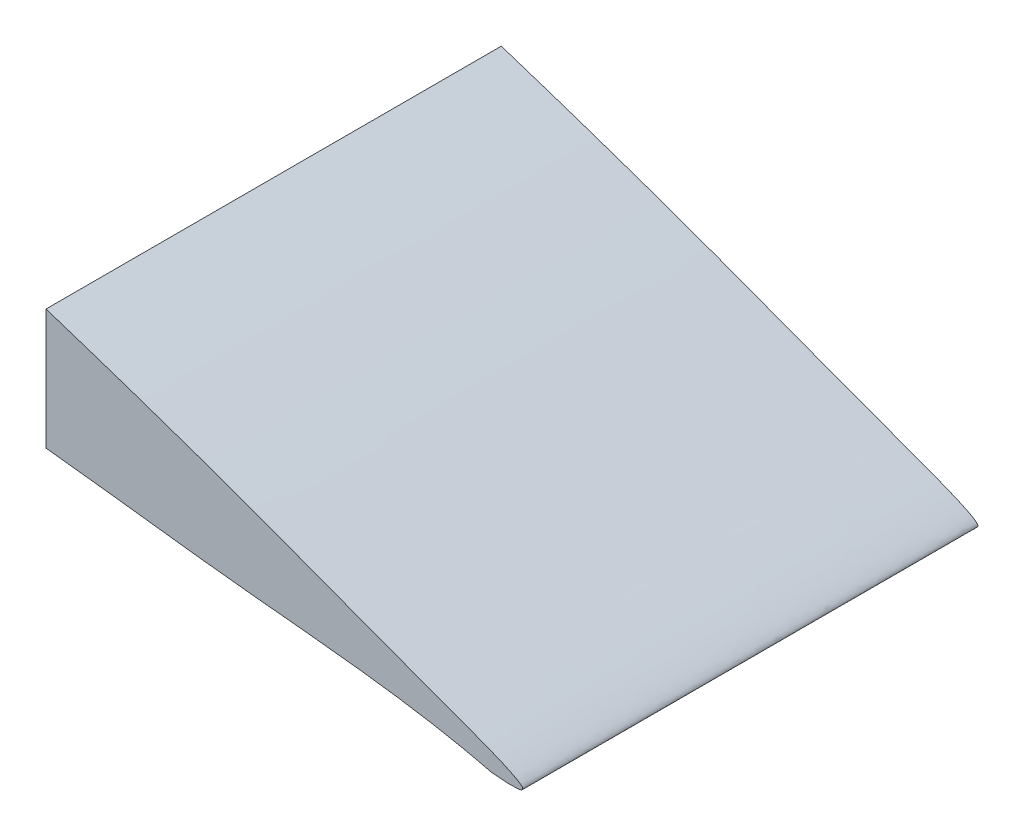
from build123d import *

# Parameters (mm, degrees)
BOSS_EXTRUDE1_DEPTH = 31.1531
SKETCH2_R           = 6.35
SKETCH2_R_2         = 3.175
CUT_EXTRUDE1_DEPTH  = 318.261218693
SKETCH4_W           = 311.512427185
SKETCH4_H           = 117.489254048
CUT_EXTRUDE3_DEPTH  = 318.261218693


with BuildPart() as part:
    # Sketch1 → Boss-Extrude1 (new body)
    with BuildSketch(Plane.XY):
        with BuildLine():
            add(Edge.make_bspline(
                [(0.000560351, 0.000130087), (0.810633127, 7.359196055), (8.649092025, 17.856605174), (26.286719818, 29.975176328), (52.111128271, 42.069215275), (89.597618475, 49.290763054), (131.400792109, 47.884831915), (173.256699242, 40.041104278), (217.961060472, 29.612974894), (256.952064401, 19.528920948), (290.35983767, 8.71099439), (301.273197721, 4.382828139), (314.816918223, -0.516206742), (309.846313895, 0.000130087)],
                knots=[0, 0, 0, 0, 0.060863618, 0.113688265, 0.188608742, 0.312908923, 0.448482434, 0.557612135, 0.691544113, 0.852438279, 0.92975597, 0.976058229, 1, 1, 1, 1], degree=3))
            add(Edge.make_bspline(
                [(309.846313895, 0.000130087), (303.956832565, 1.47095521), (293.989507544, 2.093987313), (276.26402299, 4.514356704), (260.846344817, 5.427413394), (235.858814759, 7.870306192), (205.101424636, 8.838080282), (157.718638092, 9.030650149), (110.497331172, 6.181495223), (66.506197185, -0.586669107), (36.454672816, -6.098499901), (15.316603331, -6.189065841), (1.230714189, -6.924076091), (0.000560351, 0.000130087)],
                knots=[0, 0, 0, 0, 0.057787081, 0.095274891, 0.171021118, 0.205339302, 0.335319146, 0.464904334, 0.658702312, 0.785511947, 0.893517288, 0.94309214, 1, 1, 1, 1], degree=3))
        make_face()
    extrude(amount=BOSS_EXTRUDE1_DEPTH)

    # Sketch2 → Cut-Extrude1 (cut, through all)
    with BuildSketch(Plane.XY.offset(31.1531)):
        with Locations((20.32, 10.16)):
            Circle(SKETCH2_R)
        with Locations((227.296313895, 19.050130087)):
            Circle(SKETCH2_R_2)
    extrude(amount=-CUT_EXTRUDE1_DEPTH, mode=Mode.SUBTRACT)

    # Sketch4 → Cut-Extrude3 (cut, through all)
    with BuildSketch(Plane.XY.offset(31.1531)):
        with Locations((123.643786408, 34.528076629)):
            Rectangle(SKETCH4_W, SKETCH4_H)
    extrude(amount=-CUT_EXTRUDE3_DEPTH, mode=Mode.SUBTRACT)


solid = part.part
